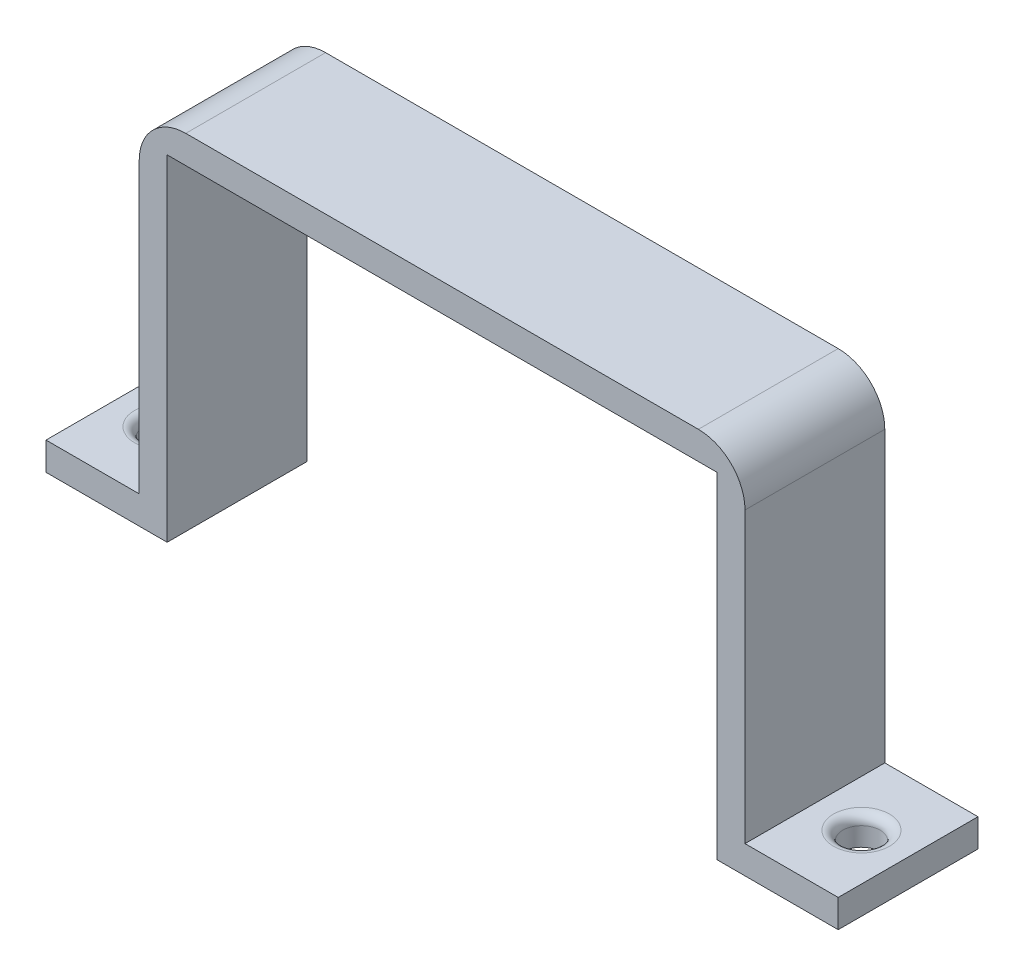
from build123d import *

# Parameters (mm, degrees)
BOSS_EXTRUDE1_DEPTH = 3
SKETCH3_W           = 3
SKETCH3_H           = 15
BOSS_EXTRUDE2_DEPTH = 36
SKETCH5_W           = 15
SKETCH5_H           = 3
BOSS_EXTRUDE3_DEPTH = 10
SKETCH6_W           = 15
SKETCH6_H           = 3
BOSS_EXTRUDE4_DEPTH = 10
CUT_EXTRUDE1_DEPTH  = 3
FILLET1_R           = 5
FILLET2_R           = 1


with BuildPart() as part:
    # Sketch2 → Boss-Extrude1 (new body)
    with BuildSketch(Plane(origin=(0, 0, 0), x_dir=(1, 0, 0), z_dir=(0, 1, 0))):
        Polygon((32.5, 0), (0, 0), (-32.5, 0), (-32.5, -7.5), (32.5, -7.5), align=None)
        Polygon((-32.5, 0), (0, 0), (32.5, 0), (32.5, 7.5), (-32.5, 7.5), align=None)
    extrude(amount=BOSS_EXTRUDE1_DEPTH)

    # Sketch3 → Boss-Extrude2 (add)
    with BuildSketch(Plane.XZ):
        Polygon((-29.5, 7.5), (-32.5, 7.5), (-32.5, -7.5), align=None)
        Polygon((-29.5, -7.5), (-29.5, 7.5), (-32.5, -7.5), align=None)
        with Locations((31, 0)):
            Rectangle(SKETCH3_W, SKETCH3_H)
    extrude(amount=BOSS_EXTRUDE2_DEPTH)

    # Sketch5 → Boss-Extrude3 (add)
    with BuildSketch(Plane(origin=(32.5, 0, 0), x_dir=(0, 0, -1), z_dir=(1, 0, 0))):
        with Locations((0, -34.5)):
            Rectangle(SKETCH5_W, SKETCH5_H)
    extrude(amount=BOSS_EXTRUDE3_DEPTH)

    # Sketch6 → Boss-Extrude4 (add)
    with BuildSketch(Plane.ZY.offset(32.5)):
        with Locations((0, -34.5)):
            Rectangle(SKETCH6_W, SKETCH6_H)
    extrude(amount=BOSS_EXTRUDE4_DEPTH)

    # Sketch7 → Cut-Extrude1 (cut)
    with BuildSketch(Plane(origin=(0, -33, 0), x_dir=(1, 0, 0), z_dir=(0, 1, 0))):
        with BuildLine():
            ThreePointArc((-35.5, 0), (-36.556284149, 1.763349198), (-38.609400392, 1.664100589))
            Line((-38.609400392, 1.664100589), (-36.390599608, -1.664100589))
            ThreePointArc((-36.390599608, -1.664100589), (-35.736650802, -0.943715851), (-35.5, 0))
        make_face()
        with BuildLine():
            Line((-36.390599608, -1.664100589), (-38.609400392, 1.664100589))
            ThreePointArc((-38.609400392, 1.664100589), (-39.164100589, -1.109400392), (-36.390599608, -1.664100589))
        make_face()
        with BuildLine():
            ThreePointArc((36.390599608, 1.664100589), (35.835899411, -1.109400392), (38.609400392, -1.664100589))
            Line((38.609400392, -1.664100589), (36.390599608, 1.664100589))
        make_face()
        with BuildLine():
            Line((36.390599608, 1.664100589), (38.609400392, -1.664100589))
            ThreePointArc((38.609400392, -1.664100589), (39.263349198, -0.943715851), (39.5, 0))
            ThreePointArc((39.5, 0), (38.443715851, 1.763349198), (36.390599608, 1.664100589))
        make_face()
    extrude(amount=-CUT_EXTRUDE1_DEPTH, mode=Mode.SUBTRACT)

    # Fillet1
    fillet1_edges = [part.edges().sort_by_distance(p)[0] for p in [
        (32.5, 3, 0),
        (-32.5, 3, 0),
    ]]
    fillet(fillet1_edges, radius=FILLET1_R)

    # Fillet2
    fillet2_edges = [part.edges().sort_by_distance(p)[0] for p in [
        (-38.609400392, -33, -1.664100589),
        (38.609400392, -33, 1.664100589),
    ]]
    fillet(fillet2_edges, radius=FILLET2_R)


solid = part.part
